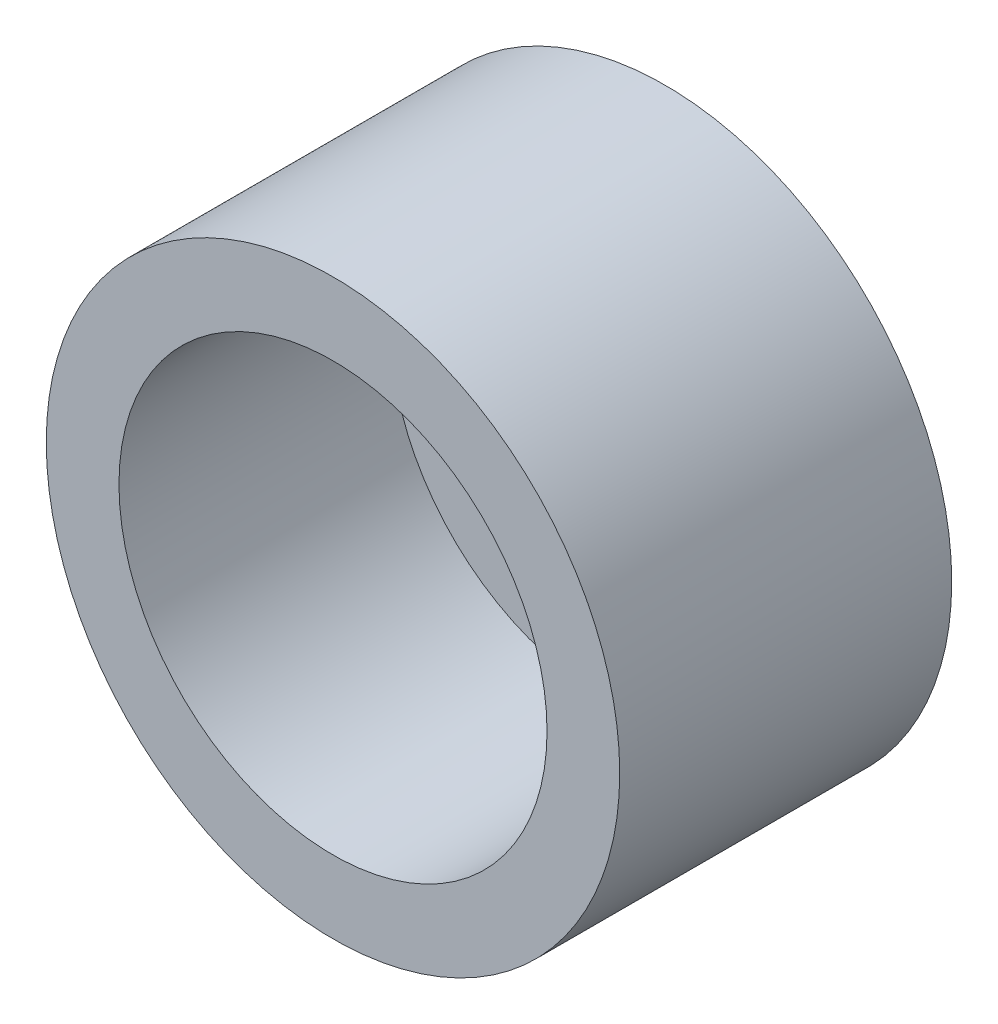
from build123d import *

# Parameters (mm, degrees)
SECTION_EXT_RIEURE_R = 9.5
EXT_RIEUR_DEPTH      = 11
SECTION_INTERIEURE_R = 7.0915
INT_RIEUR_DEPTH      = 9


with BuildPart() as part:
    # section-extérieure → extérieur (new body)
    with BuildSketch(Plane.XY):
        Circle(SECTION_EXT_RIEURE_R)
    extrude(amount=-EXT_RIEUR_DEPTH)

    # section interieure → intérieur (cut)
    with BuildSketch(Plane.XY):
        Circle(SECTION_INTERIEURE_R)
    extrude(amount=-INT_RIEUR_DEPTH, mode=Mode.SUBTRACT)


solid = part.part
